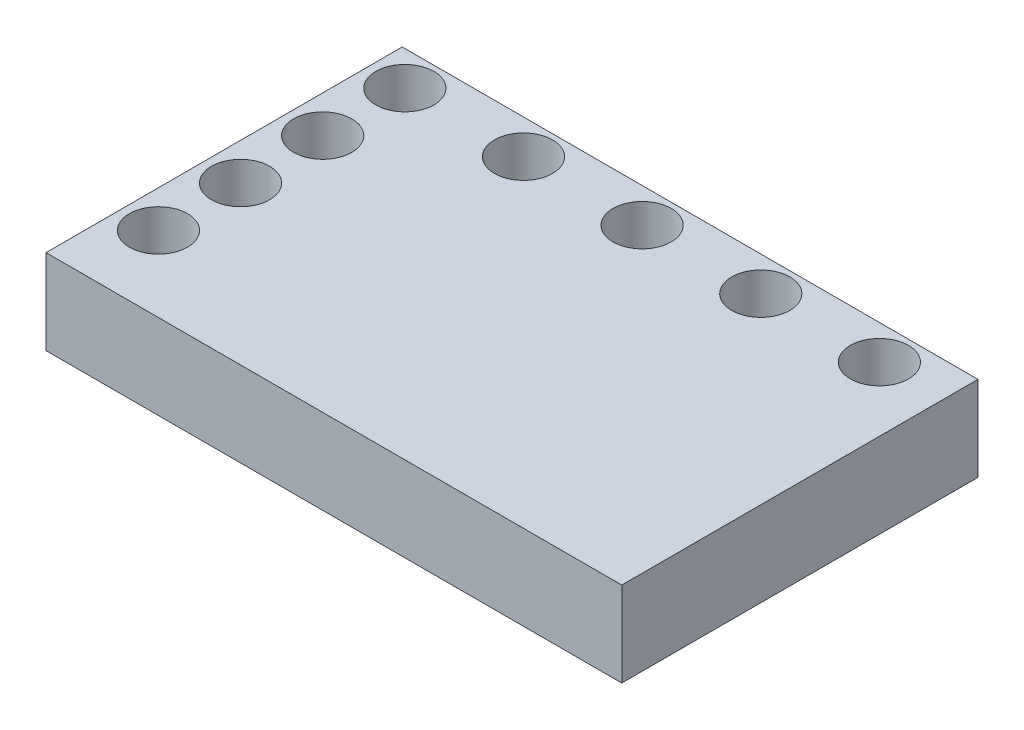
from build123d import *

# Parameters (mm, degrees)
SKETCH1_W           = 320.474741716
SKETCH1_H           = 198.285814429
BOSS_EXTRUDE1_DEPTH = 23.622
SKETCH2_R           = 16.182303952
CUT_EXTRUDE1_DEPTH  = 47.244
LPATTERN1_COUNT     = 5
LPATTERN1_PITCH     = 66.04
LPATTERN1_COL_COUNT = 4
LPATTERN1_COL_PITCH = 45.72


with BuildPart() as part:
    # Sketch1 → Boss-Extrude1 (new, symmetric)
    with BuildSketch(Plane(origin=(0, 0, 0), x_dir=(1, 0, 0), z_dir=(0, 1, 0))):
        with Locations((14.200022321, -53.127541738)):
            Rectangle(SKETCH1_W, SKETCH1_H)
    extrude(amount=BOSS_EXTRUDE1_DEPTH, both=True)

    # Sketch2 → Cut-Extrude1 (cut)
    with BuildSketch(Plane(origin=(0, 23.622, 0), x_dir=(1, 0, 0), z_dir=(0, 1, 0))):
        with Locations(Location((-125.445944565, 26.871307357, 0), (0, 0, 270))):
            Circle(SKETCH2_R)
    cut_extrude1 = extrude(amount=-CUT_EXTRUDE1_DEPTH, mode=Mode.SUBTRACT)

    # LPattern1: Cut-Extrude1 ×5
    with Locations(*[(i * LPATTERN1_PITCH, 0, 0) for i in range(1, LPATTERN1_COUNT)]):
        add(cut_extrude1, mode=Mode.SUBTRACT)

    # LPattern1 col: Cut-Extrude1 ×4
    with Locations(*[(0, 0, i * LPATTERN1_COL_PITCH) for i in range(1, LPATTERN1_COL_COUNT)]):
        add(cut_extrude1, mode=Mode.SUBTRACT)


solid = part.part
